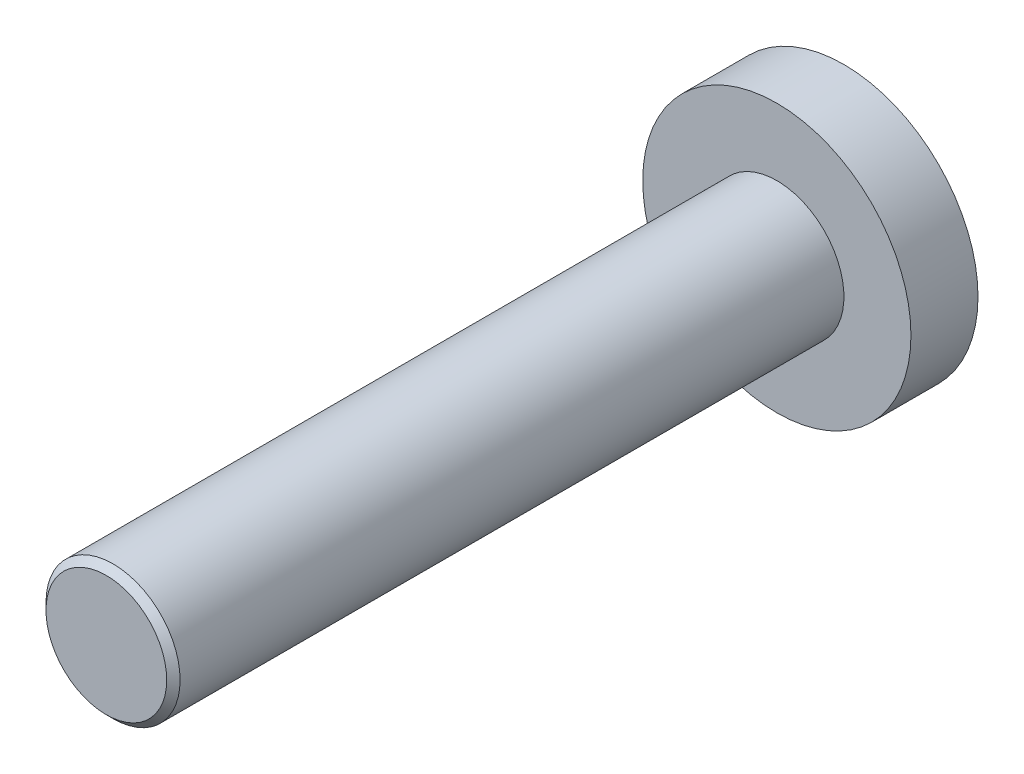
from build123d import *

# Parameters (mm, degrees)
SKETCH_1_R      = 2
EXTRUDE_1_DEPTH = 20
SKETCH_2_R      = 4
EXTRUDE_2_DEPTH = 2
CHAMFER_1_SIZE  = 0.2


with BuildPart() as part:
    # 草图1 → 拉伸1 (new body)
    with BuildSketch(Plane.XY):
        Circle(SKETCH_1_R)
    extrude(amount=EXTRUDE_1_DEPTH)

    # 草图2 → 拉伸2 (add)
    with BuildSketch(Plane(origin=(0, 0, 0), x_dir=(-1, 0, 0), z_dir=(0, 0, -1))):
        Circle(SKETCH_2_R)
    extrude(amount=EXTRUDE_2_DEPTH)

    # 倒角1
    chamfer_1_edges = [part.edges().sort_by_distance(p)[0] for p in [
        (-2, 0, 20),
    ]]
    chamfer(chamfer_1_edges, length=CHAMFER_1_SIZE)


solid = part.part
